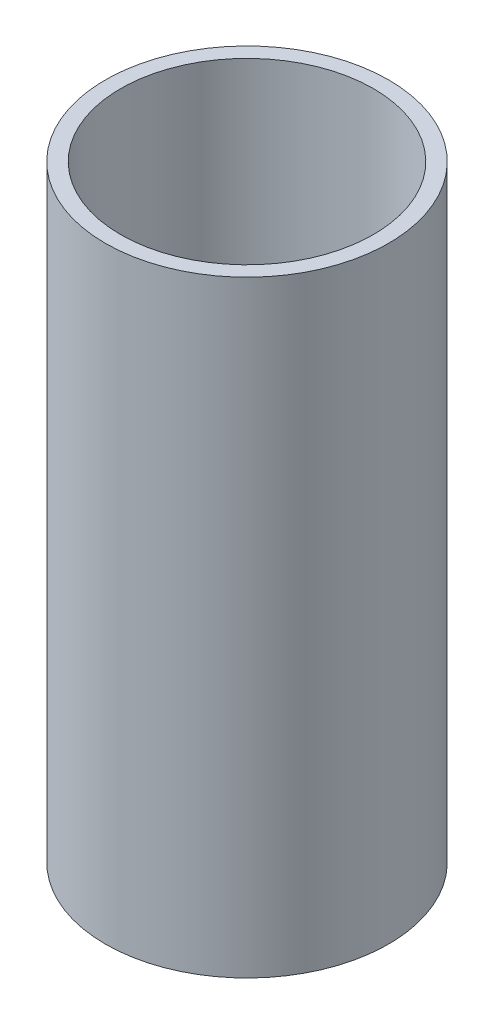
from build123d import *

# Parameters (mm, degrees)
CROQUIS1_R              = 14
CROQUIS1_R_2            = 12.5
SALIENTE_EXTRUIR1_DEPTH = 60


with BuildPart() as part:
    # Croquis1 → Saliente-Extruir1 (new body)
    with BuildSketch(Plane(origin=(0, 0, 0), x_dir=(1, 0, 0), z_dir=(0, 1, 0))):
        with Locations(Location((0, 0, 0), (0, 0, 270))):
            Circle(CROQUIS1_R)
        with Locations(Location((0, 0, 0), (0, 0, 270))):
            Circle(CROQUIS1_R_2, mode=Mode.SUBTRACT)
    extrude(amount=SALIENTE_EXTRUIR1_DEPTH)


solid = part.part
